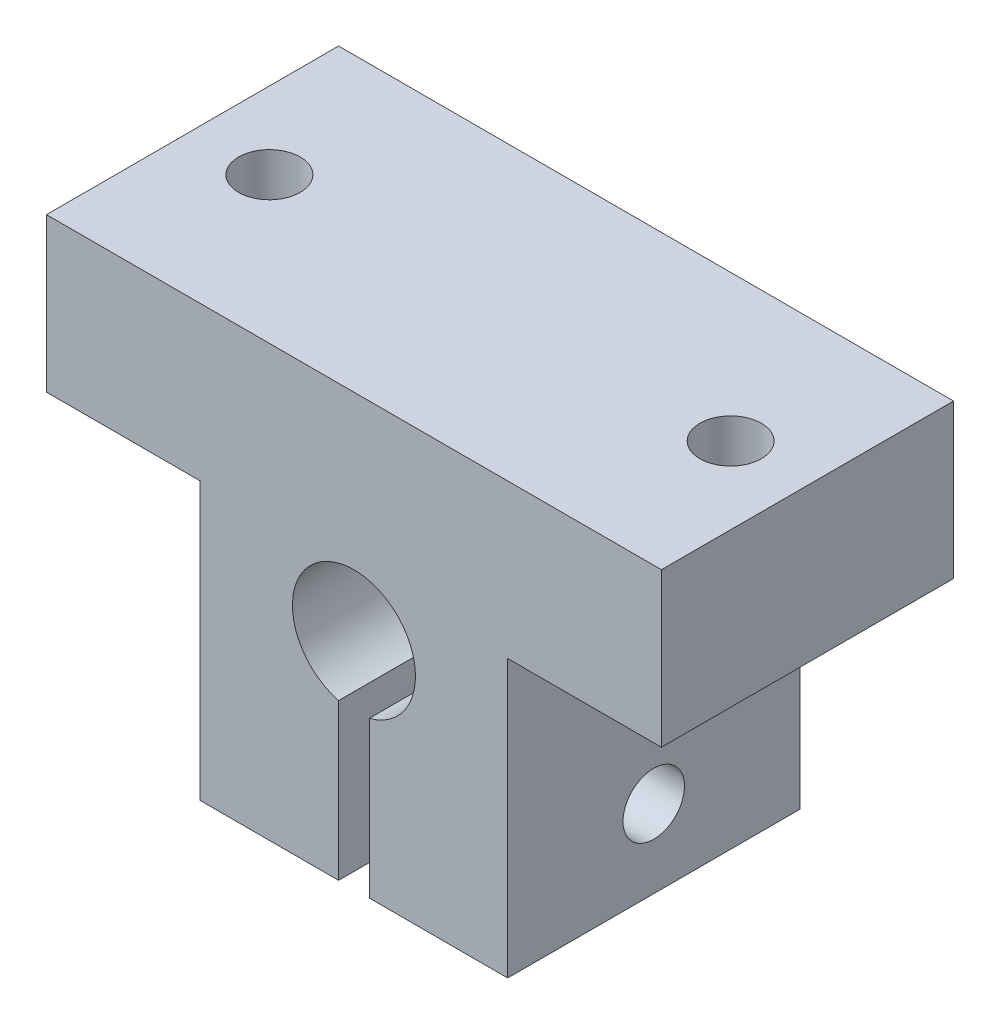
from build123d import *

# Parameters (mm, degrees)
SKETCH1_R               = 4
BOSS_EXTRUDE1_DEPTH     = 19
SKETCH3_R               = 2
CUT_EXTRUDE2_DEPTH      = 10
SKETCH4_W               = 2
SKETCH4_H               = 25.552295944
CUT_EXTRUDE3_DEPTH      = 19
CUT_EXTRUDE4_DEPTH      = 40.824615503
CUT_EXTRUDE4_DEPTH_BACK = 40.824615503
SKETCH5_R               = 2


with BuildPart() as part:
    # Sketch1 → Boss-Extrude1 (new body)
    with BuildSketch(Plane.XY):
        Polygon((50, 0), (90, 0), (90, -10), (80, -10), (80, -28), (60, -28), (60, -10), (50, -10), align=None)
        with Locations((70, -14)):
            Circle(SKETCH1_R, mode=Mode.SUBTRACT)
    extrude(amount=BOSS_EXTRUDE1_DEPTH)

    # Sketch3 → Cut-Extrude2 (cut)
    with BuildSketch(Plane(origin=(0, -10, 0), x_dir=(-1, 0, 0), z_dir=(0, -1, 0))):
        with Locations(Location((-85, -9.5, 0), (0, 0, 90))):
            Circle(SKETCH3_R)
        with Locations(Location((-55, -9.5, 0), (0, 0, 90))):
            Circle(SKETCH3_R)
    extrude(amount=-CUT_EXTRUDE2_DEPTH, mode=Mode.SUBTRACT)

    # Sketch4 → Cut-Extrude3 (cut)
    with BuildSketch(Plane.XY.offset(19)):
        with Locations((70, -28)):
            Rectangle(SKETCH4_W, SKETCH4_H)
    extrude(amount=-CUT_EXTRUDE3_DEPTH, mode=Mode.SUBTRACT)

    # Sketch5 → Cut-Extrude4 (cut, two sides: drawn at the far end of the back side and taken through both)
    with BuildSketch(Plane.ZY.offset(-71).offset(-CUT_EXTRUDE4_DEPTH_BACK)):
        with Locations((9.5, -22.936491673)):
            Circle(SKETCH5_R)
    extrude(amount=CUT_EXTRUDE4_DEPTH + CUT_EXTRUDE4_DEPTH_BACK, mode=Mode.SUBTRACT)


solid = part.part
